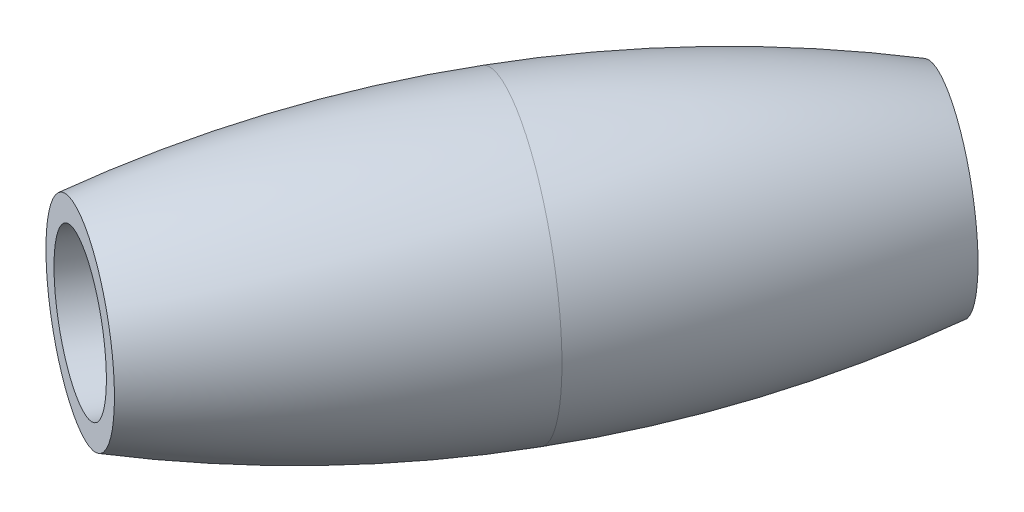
from build123d import *


with BuildPart() as part:
    # Sketch5 → Revolve2 (revolve)
    with BuildSketch(Plane(origin=(0, 0, 8.965754722), x_dir=(-1, 0, 0), z_dir=(0, 1, 0))):
        with BuildLine():
            Line((-35.394644427, -1.215527607), (-34.264481275, -1.868027607))
            Line((-34.264481275, -1.868027607), (-15.514481275, 30.607925035))
            Line((-15.514481275, 30.607925035), (-16.644644427, 31.260425035))
            ThreePointArc((-16.644644427, 31.260425035), (-22.941967953, 24.170371413), (-28.228009206, 16.297448714))
            ThreePointArc((-28.228009206, 16.297448714), (-32.40313964, 7.783141354), (-35.394644427, -1.215527607))
        make_face()
    revolve(axis=Axis((25.900703436, 0, 13.094215275), (-0.5000000000000001, 0, 0.8660254037844387)))


solid = part.part
